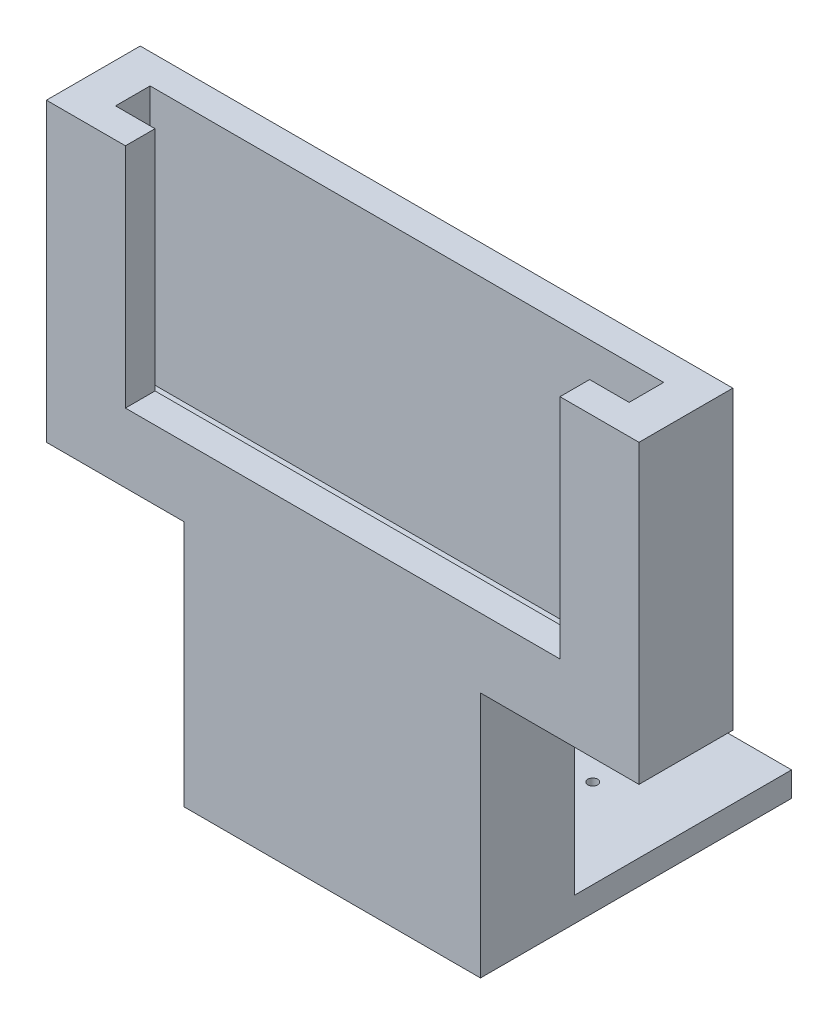
from build123d import *

# Parameters (mm, degrees)
ESQUISSE1_W             = 60
ESQUISSE1_H             = 30
ESQUISSE1_W_2           = 30
ESQUISSE1_H_2           = 25
BOSS_EXTRU_1_DEPTH      = 3
ESQUISSE2_W             = 30
ESQUISSE2_H             = 25
BOSS_EXTRU_2_DEPTH      = 3.5
ESQUISSE3_W             = 30
ESQUISSE3_H             = 25
BOSS_EXTRU_3_DEPTH      = 3
ESQUISSE4_W             = 30
ESQUISSE4_H             = 2.5
BOSS_EXTRU_4_DEPTH      = 22
ESQUISSE6_R             = 3
ENL_V_MAT_EXTRU_1_DEPTH = 1.5
ESQUISSE7_R             = 1.5
ENL_V_MAT_EXTRU_2_DEPTH = 6
ESQUISSE8_R             = 0.5
ENL_V_MAT_EXTRU_3_DEPTH = 10


with BuildPart() as part:
    # Esquisse1 → Boss.-Extru.1 (new body)
    with BuildSketch(Plane.XY):
        Rectangle(ESQUISSE1_W, ESQUISSE1_H)
        with Locations((-1.048951049, -27.5)):
            Rectangle(ESQUISSE1_W_2, ESQUISSE1_H_2)
    extrude(amount=BOSS_EXTRU_1_DEPTH)

    # Esquisse2 → Boss.-Extru.2 (add)
    with BuildSketch(Plane.XY.offset(3)):
        Polygon((-26, 15), (-30, 15), (-30, -15), (-26, -15), (-26, -11), align=None)
        Polygon((26, -11), (-26, -11), (-26, -15), (-16.048951049, -15), (13.951048951, -15), (26, -15), align=None)
        Polygon((26, 15), (26, -11), (26, -15), (30, -15), (30, 15), align=None)
        with Locations((-1.048951049, -27.5)):
            Rectangle(ESQUISSE2_W, ESQUISSE2_H)
    extrude(amount=BOSS_EXTRU_2_DEPTH)

    # Esquisse3 → Boss.-Extru.3 (add)
    with BuildSketch(Plane.XY.offset(6.5)):
        Polygon((-22, 15), (-30, 15), (-30, -15), (-22, -15), (-22, -8), align=None)
        Polygon((22, -8), (-22, -8), (-22, -15), (-16.048951049, -15), (13.951048951, -15), (22, -15), align=None)
        Polygon((22, 15), (22, -8), (22, -15), (30, -15), (30, 15), align=None)
        with Locations((-1.048951049, -27.5)):
            Rectangle(ESQUISSE3_W, ESQUISSE3_H)
    extrude(amount=BOSS_EXTRU_3_DEPTH)

    # Esquisse4 → Boss.-Extru.4 (add)
    with BuildSketch(Plane(origin=(0, 0, 0), x_dir=(-1, 0, 0), z_dir=(0, 0, -1))):
        with Locations((1.048951049, -38.75)):
            Rectangle(ESQUISSE4_W, ESQUISSE4_H)
    extrude(amount=BOSS_EXTRU_4_DEPTH)

    # Esquisse6 → Enlèv. mat.-Extru.1 (cut)
    with BuildSketch(Plane.XZ.offset(40)):
        with Locations((-1.048951049, -10.86835965)):
            Circle(ESQUISSE6_R)
    extrude(amount=-ENL_V_MAT_EXTRU_1_DEPTH, mode=Mode.SUBTRACT)

    # Esquisse7 → Enlèv. mat.-Extru.2 (cut)
    with BuildSketch(Plane.XZ.offset(38.5)):
        with Locations((-1.048951049, -10.86835965)):
            Circle(ESQUISSE7_R)
    extrude(amount=-ENL_V_MAT_EXTRU_2_DEPTH, mode=Mode.SUBTRACT)

    # Esquisse8 → Enlèv. mat.-Extru.3 (cut)
    with BuildSketch(Plane.XZ.offset(40)):
        with Locations((-1.048951049, -4.86835965)):
            Circle(ESQUISSE8_R)
        with Locations((-1.048951049, -16.86835965)):
            Circle(ESQUISSE8_R)
        with Locations((4.951048951, -10.86835965)):
            Circle(ESQUISSE8_R)
        with Locations((-7.048951049, -10.86835965)):
            Circle(ESQUISSE8_R)
    extrude(amount=-ENL_V_MAT_EXTRU_3_DEPTH, mode=Mode.SUBTRACT)


solid = part.part
